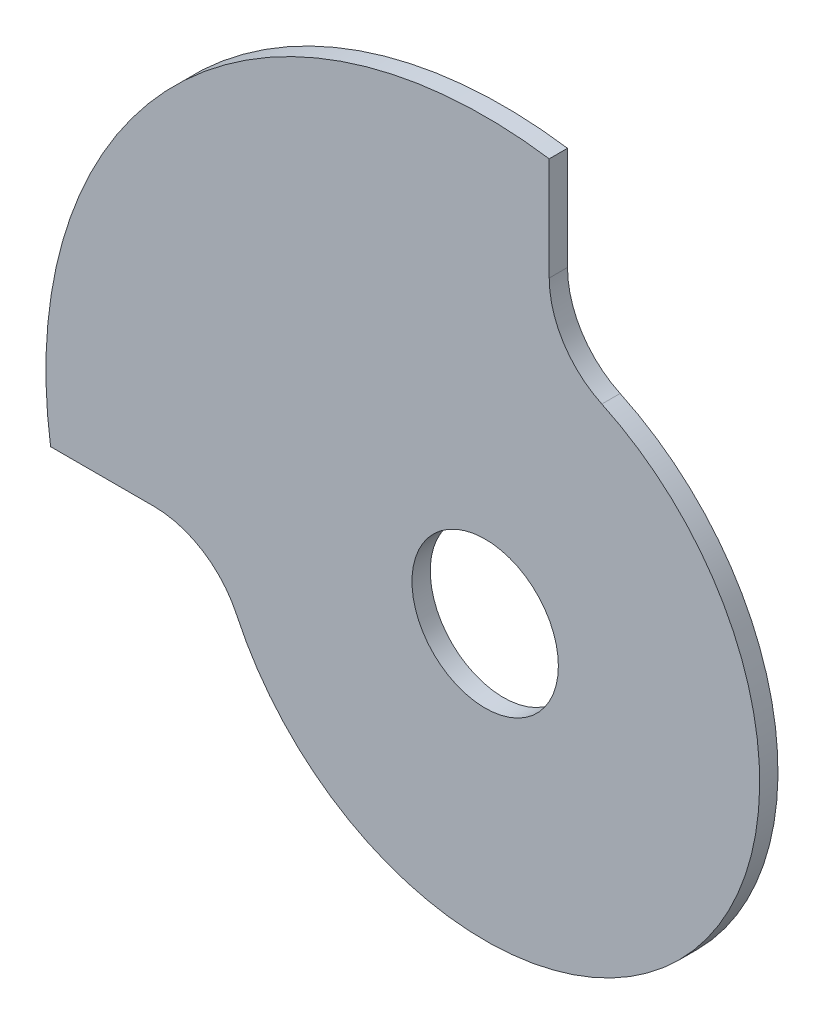
from build123d import *

# Parameters (mm, degrees)
SKETCH_1_R          = 24
EXTRUDE_1_DEPTH     = 1
CUT_EXTRUDE_START   = -1
SKETCH_2_R          = 4
CUT_EXTRUDE_1_DEPTH = 1
FILLET_1_R          = 5
FILLET_2_R          = 5


with BuildPart() as part:
    # 草图1 → 拉伸1 (new body)
    with BuildSketch(Plane.XY):
        Circle(SKETCH_1_R)
    extrude(amount=EXTRUDE_1_DEPTH)

    # 草图2 → 切除-拉伸1 (cut)
    with BuildSketch(Plane.XY.offset(1).offset(CUT_EXTRUDE_START)):
        Circle(SKETCH_2_R)
        with BuildLine():
            Line((-23.743420141, -3.5), (-14.585952146, -3.5))
            ThreePointArc((-14.585952146, -3.5), (10.606601718, -10.606601718), (3.5, 14.585952146))
            Line((3.5, 14.585952146), (3.5, 23.743420141))
            ThreePointArc((3.5, 23.743420141), (16.970562748, -16.970562748), (-23.743420141, -3.5))
        make_face()
    extrude(amount=CUT_EXTRUDE_1_DEPTH, mode=Mode.SUBTRACT)

    # 圆角1
    fillet_1_edges = [part.edges().sort_by_distance(p)[0] for p in [
        (-14.585952146, -3.5, 0.5),
    ]]
    fillet(fillet_1_edges, radius=FILLET_1_R)

    # 圆角2
    fillet_2_edges = [part.edges().sort_by_distance(p)[0] for p in [
        (3.5, 14.585952146, 0.5),
    ]]
    fillet(fillet_2_edges, radius=FILLET_2_R)


solid = part.part
